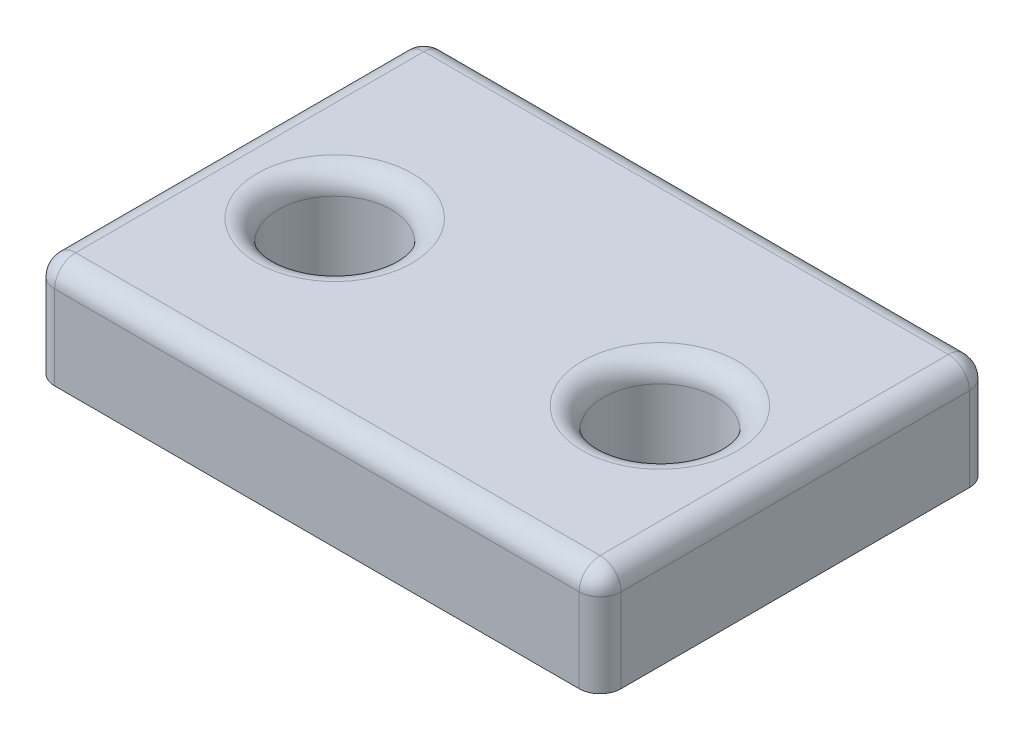
from build123d import *

# Parameters (mm, degrees)
SKETCH_1_W      = 27
SKETCH_1_H      = 18.6
SKETCH_1_R      = 2.7
EXTRUDE_1_DEPTH = 5
FILLET_2_R      = 1
FILLET_3_R      = 1


with BuildPart() as part:
    # 草图1 → 凸台-拉伸1 (new body)
    with BuildSketch(Plane(origin=(0, 0, 0), x_dir=(1, 0, 0), z_dir=(0, 1, 0))):
        with Locations((13.5, -9.3)):
            Rectangle(SKETCH_1_W, SKETCH_1_H)
        with Locations(Location((5.75, -10, 0), (0, 0, 270))):
            Circle(SKETCH_1_R, mode=Mode.SUBTRACT)
        with Locations(Location((21.25, -10, 0), (0, 0, 270))):
            Circle(SKETCH_1_R, mode=Mode.SUBTRACT)
    extrude(amount=EXTRUDE_1_DEPTH)

    # 圆角2
    fillet_2_edges = [part.edges().sort_by_distance(p)[0] for p in [
        (0, 2.5, 0),
        (27, 2.5, 0),
        (27, 2.5, 18.6),
        (0, 2.5, 18.6),
    ]]
    fillet(fillet_2_edges, radius=FILLET_2_R)

    # 圆角3
    fillet_3_edges = [part.edges().sort_by_distance(p)[0] for p in [
        (5.75, 5, 7.3),
        (21.25, 5, 7.3),
        (0, 5, 9.3),
        (13.5, 5, 0),
        (13.5, 5, 18.6),
        (27, 5, 9.3),
        (26.707106781, 5, 18.307106781),
        (0.292893219, 5, 18.307106781),
        (26.707106781, 5, 0.292893219),
        (0.292893219, 5, 0.292893219),
    ]]
    fillet(fillet_3_edges, radius=FILLET_3_R)


solid = part.part
